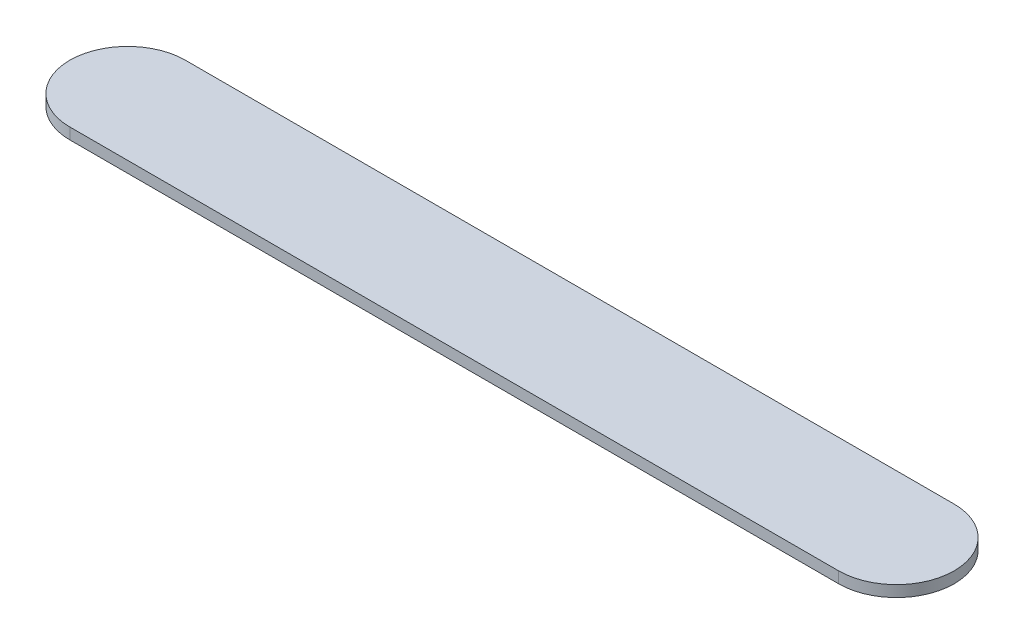
from build123d import *

# Parameters (mm, degrees)
BOSS_EXTRUDE1_DEPTH = 2


with BuildPart() as part:
    # Sketch1 → Boss-Extrude1 (new body)
    with BuildSketch(Plane(origin=(0, 0, 0), x_dir=(1, 0, 0), z_dir=(0, 1, 0))):
        with BuildLine():
            Line((-68.50463574, -7.073848256), (0, -7.073848256))
            Line((0, -7.073848256), (0, 13.527183507))
            Line((0, 13.527183507), (-68.50463574, 13.527183507))
            ThreePointArc((-68.50463574, 13.527183507), (-78.805151621, 3.226667625), (-68.50463574, -7.073848256))
        make_face()
    extrude(amount=BOSS_EXTRUDE1_DEPTH)

    # Mirror1: part across plane


with BuildPart() as part_1:
    add(part.part)
    add(part.part.mirror(Plane(origin=(0, 2, 7.073848256), x_dir=(0, 0, 1), z_dir=(-1, 0, 0))))


solid = part_1.part
